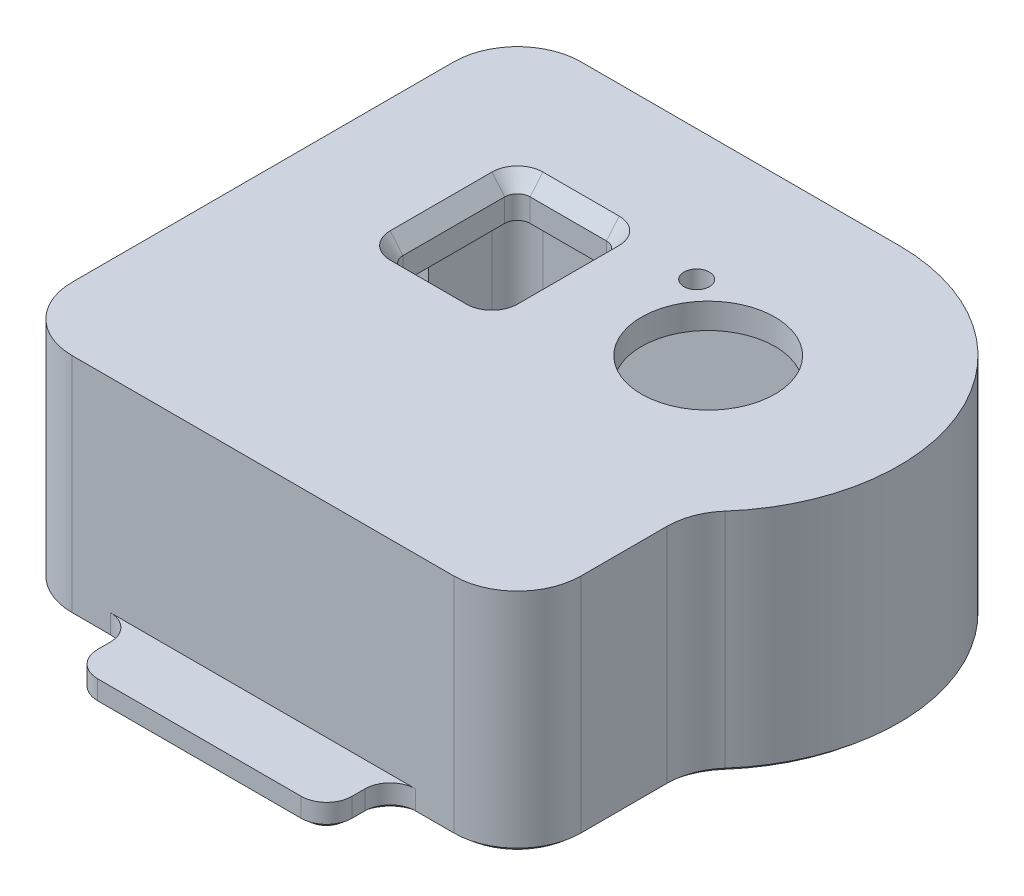
from build123d import *
from OCP.BRepFilletAPI import BRepFilletAPI_MakeChamfer

# Parameters (mm, degrees)
BOSS_EXTRUDE1_DEPTH = 18
FILLET1_R           = 5
SHELL1_T            = -3
SKETCH3_R           = 5.25
CUT_EXTRUDE1_DEPTH  = 44
SKETCH4_R           = 11.5
CUT_EXTRUDE2_DEPTH  = 1
SKETCH5_R           = 1
CUT_EXTRUDE3_DEPTH  = 44
CUT_EXTRUDE4_REACH  = 56.534
SKETCH6_W           = 10
SKETCH6_H           = 10
FILLET2_R           = 1
CUT_EXTRUDE7_REACH  = 45
SKETCH7_W           = 8
SKETCH7_H           = 10
FILLET3_R           = 1
SKETCH8_W           = 20
SKETCH8_H           = 5
SKETCH8_W_2         = 15
BOSS_EXTRUDE2_DEPTH = 2
FILLET4_R           = 2
FILLET5_R           = 5
FILLET6_R           = 5
CHAMFER2_SIZE       = 1
CHAMFER2_SIZE2      = 1.191753593
CHAMFER3_SIZE       = 0.5
CHAMFER3_SIZE2      = 0.595876796


with BuildPart() as part:
    # Sketch1 → Boss-Extrude1 (new body)
    with BuildSketch(Plane(origin=(0, 0, 0), x_dir=(1, 0, 0), z_dir=(0, 1, 0))):
        with BuildLine():
            Line((0, 15), (-30, 15))
            Line((-30, 15), (-30, -25))
            Line((-30, -25), (10, -25))
            Line((10, -25), (10, -11.180339887))
            ThreePointArc((10, -11.180339887), (14.012585384, 5.352331347), (0, 15))
        make_face()
    extrude(amount=BOSS_EXTRUDE1_DEPTH)

    # Fillet1
    fillet1_edges = [part.edges().sort_by_distance(p)[0] for p in [
        (10, 9, 25),
        (-30, 9, 25),
        (-30, 9, -15),
    ]]
    fillet(fillet1_edges, radius=FILLET1_R)

    # Shell1
    shell1_openings = [part.faces().sort_by_distance(p)[0] for p in [
        (-9.03204336, 0, 4.841264845),
    ]]
    offset(amount=SHELL1_T, openings=shell1_openings, kind=Kind.INTERSECTION)

    # Sketch3 → Cut-Extrude1 (cut, through all)
    with BuildSketch(Plane(origin=(0, 18, 0), x_dir=(1, 0, 0), z_dir=(0, 1, 0))):
        with Locations(Location((0, 0, 0), (0, 0, 270))):
            Circle(SKETCH3_R)
    extrude(amount=-CUT_EXTRUDE1_DEPTH, mode=Mode.SUBTRACT)

    # Sketch4 → Cut-Extrude2 (cut)
    with BuildSketch(Plane.XZ.offset(-15)):
        with Locations(Location((0, 0, 0), (0, 0, 270))):
            Circle(SKETCH4_R)
    extrude(amount=-CUT_EXTRUDE2_DEPTH, mode=Mode.SUBTRACT)

    # Sketch5 → Cut-Extrude3 (cut, through all)
    with BuildSketch(Plane(origin=(0, 18, 0), x_dir=(1, 0, 0), z_dir=(0, 1, 0))):
        with Locations(Location((-5.645747546, 4.737344683, 0), (0, 0, 270))):
            Circle(SKETCH5_R)
    extrude(amount=-CUT_EXTRUDE3_DEPTH, mode=Mode.SUBTRACT)

    # Sketch6 → Cut-Extrude4 (cut, up to next)
    with BuildSketch(Plane.ZY.offset(30), mode=Mode.PRIVATE) as cut_extrude4_sk1:
        with Locations((0, 5)):
            Rectangle(SKETCH6_W, SKETCH6_H)
    cut_extrude4_tool1 = extrude(cut_extrude4_sk1.sketch, amount=-CUT_EXTRUDE4_REACH, mode=Mode.PRIVATE) & part.part
    add(cut_extrude4_tool1.solids().sort_by_distance((-30, 5, 0))[0], mode=Mode.SUBTRACT)

    # Fillet2
    fillet2_edges = [part.edges().sort_by_distance(p)[0] for p in [
        (-28.5, 10, 5),
        (-28.5, 10, -5),
    ]]
    fillet(fillet2_edges, radius=FILLET2_R)

    # Sketch7 → Cut-Extrude7 (cut, up to next)
    with BuildSketch(Plane(origin=(0, 18, 0), x_dir=(1, 0, 0), z_dir=(0, 1, 0)), mode=Mode.PRIVATE) as cut_extrude7_sk1:
        with Locations((-16, 0)):
            Rectangle(SKETCH7_W, SKETCH7_H)
    cut_extrude7_tool1 = extrude(cut_extrude7_sk1.sketch, amount=-CUT_EXTRUDE7_REACH, mode=Mode.PRIVATE) & part.part
    add(cut_extrude7_tool1.solids().sort_by_distance((-16, 18, 0))[0], mode=Mode.SUBTRACT)

    # Fillet3
    fillet3_edges = [part.edges().sort_by_distance(p)[0] for p in [
        (-20, 16.5, 5),
        (-20, 16.5, -5),
        (-12, 16.5, -5),
        (-12, 16.5, 5),
    ]]
    fillet(fillet3_edges, radius=FILLET3_R)

    # Sketch8 → Boss-Extrude2 (add)
    with BuildSketch(Plane.XZ):
        with Locations((-10, 27.5)):
            Rectangle(SKETCH8_W, SKETCH8_H)
        with Locations((-15, -17.5)):
            Rectangle(SKETCH8_W_2, SKETCH8_H)
    extrude(amount=-BOSS_EXTRUDE2_DEPTH)

    # Fillet4
    fillet4_edges = [part.edges().sort_by_distance(p)[0] for p in [
        (-20, 1, 25),
        (-20, 1, 30),
        (0, 1, 30),
        (0, 1, 25),
        (-22.5, 1, -20),
        (-22.5, 1, -15),
        (-7.5, 1, -15),
        (-7.5, 1, -20),
    ]]
    fillet(fillet4_edges, radius=FILLET4_R)

    # Fillet5
    fillet5_edges = [part.edges().sort_by_distance(p)[0] for p in [
        (10, 9, 11.180339887),
    ]]
    fillet(fillet5_edges, radius=FILLET5_R)

    # Fillet6
    fillet6_edges = [part.edges().sort_by_distance(p)[0] for p in [
        (7, 7.5, 9.746794345),
    ]]
    fillet(fillet6_edges, radius=FILLET6_R)

    # Chamfer2
    chamfer2_edges = [part.edges().sort_by_distance(p)[0] for p in [
        (-16, 18, -5),
        (-12, 18, 0),
        (-16, 18, 5),
        (-20, 18, 0),
        (-12.292893219, 18, -4.707106781),
        (-12.292893219, 18, 4.707106781),
        (-19.707106781, 18, 4.707106781),
        (-19.707106781, 18, -4.707106781),
    ]]
    chamfer2_side = [part.faces().sort_by_distance(p)[0] for p in [
        (-9.188665207, 18, 5.405494126),
    ]]
    chamfer(chamfer2_edges, length=CHAMFER2_SIZE, length2=CHAMFER2_SIZE2, reference=chamfer2_side[0])

    # Chamfer3: one chamfer whose edges measure the first distance from different faces: ONE call of the kernel's chamfer builder (chamfer() names one face for all edges)
    chamfer3_edges_1 = [part.edges().sort_by_distance(p)[0] for p in [
        (10, 0, 16.614378278),
    ]]
    chamfer3_side_1 = [part.faces().sort_by_distance(p)[0] for p in [
        (10, 9, 16.614378278),
    ]]
    chamfer3_edges_2 = [part.edges().sort_by_distance(p)[0] for p in [
        (-22.5, 0, -17.5),
    ]]
    chamfer3_side_2 = [part.faces().sort_by_distance(p)[0] for p in [
        (-22.5, 1, -17.5),
    ]]
    chamfer3_edges_3 = [part.edges().sort_by_distance(p)[0] for p in [
        (-24.75, 0, -15),
        (-2.75, 0, -15),
    ]]
    chamfer3_side_3 = [part.faces().sort_by_distance(p)[0] for p in [
        (-12.269417476, 9.737864078, -15),
    ]]
    chamfer3_edges_4 = [part.edges().sort_by_distance(p)[0] for p in [
        (-15, 0, -20),
    ]]
    chamfer3_side_4 = [part.faces().sort_by_distance(p)[0] for p in [
        (-15, 1, -20),
    ]]
    chamfer3_edges_5 = [part.edges().sort_by_distance(p)[0] for p in [
        (-7.5, 0, -17.5),
    ]]
    chamfer3_side_5 = [part.faces().sort_by_distance(p)[0] for p in [
        (-7.5, 1, -17.5),
    ]]
    chamfer3_edges_6 = [part.edges().sort_by_distance(p)[0] for p in [
        (3.5, 0, 25),
        (-23.5, 0, 25),
    ]]
    chamfer3_side_6 = [part.faces().sort_by_distance(p)[0] for p in [
        (-10, 9.780487805, 25),
    ]]
    chamfer3_edges_7 = [part.edges().sort_by_distance(p)[0] for p in [
        (0, 0, 27.5),
    ]]
    chamfer3_side_7 = [part.faces().sort_by_distance(p)[0] for p in [
        (0, 1, 27.5),
    ]]
    chamfer3_edges_8 = [part.edges().sort_by_distance(p)[0] for p in [
        (-10, 0, 30),
    ]]
    chamfer3_side_8 = [part.faces().sort_by_distance(p)[0] for p in [
        (-10, 1, 30),
    ]]
    chamfer3_edges_9 = [part.edges().sort_by_distance(p)[0] for p in [
        (-20, 0, 27.5),
    ]]
    chamfer3_side_9 = [part.faces().sort_by_distance(p)[0] for p in [
        (-20, 1, 27.5),
    ]]
    chamfer3_edges_10 = [part.edges().sort_by_distance(p)[0] for p in [
        (-19.414213562, 0, 29.414213562),
    ]]
    chamfer3_side_10 = [part.faces().sort_by_distance(p)[0] for p in [
        (-19.414213562, 1, 29.414213562),
    ]]
    chamfer3_edges_11 = [part.edges().sort_by_distance(p)[0] for p in [
        (-0.585786438, 0, 29.414213562),
    ]]
    chamfer3_side_11 = [part.faces().sort_by_distance(p)[0] for p in [
        (-0.585786438, 1, 29.414213562),
    ]]
    chamfer3_edges_12 = [part.edges().sort_by_distance(p)[0] for p in [
        (-8.085786438, 0, -19.414213562),
    ]]
    chamfer3_side_12 = [part.faces().sort_by_distance(p)[0] for p in [
        (-8.085786438, 1, -19.414213562),
    ]]
    chamfer3_edges_13 = [part.edges().sort_by_distance(p)[0] for p in [
        (-21.914213562, 0, -19.414213562),
    ]]
    chamfer3_side_13 = [part.faces().sort_by_distance(p)[0] for p in [
        (-21.914213562, 1, -19.414213562),
    ]]
    chamfer3_edges_14 = [part.edges().sort_by_distance(p)[0] for p in [
        (-30, 0, -7.5),
        (-30, 0, 12.5),
    ]]
    chamfer3_side_14 = [part.faces().sort_by_distance(p)[0] for p in [
        (-30, 9.908961826, 6.130383675),
    ]]
    chamfer3_edges_15 = [part.edges().sort_by_distance(p)[0] for p in [
        (-28.535533906, 0, -13.535533906),
    ]]
    chamfer3_side_15 = [part.faces().sort_by_distance(p)[0] for p in [
        (-28.535533906, 9, -13.535533906),
    ]]
    chamfer3_edges_16 = [part.edges().sort_by_distance(p)[0] for p in [
        (-23.085786438, 0, -15.585786438),
    ]]
    chamfer3_side_16 = [part.faces().sort_by_distance(p)[0] for p in [
        (-23.085786438, 1, -15.585786438),
    ]]
    chamfer3_edges_17 = [part.edges().sort_by_distance(p)[0] for p in [
        (-28.535533906, 0, 23.535533906),
    ]]
    chamfer3_side_17 = [part.faces().sort_by_distance(p)[0] for p in [
        (-28.535533906, 9, 23.535533906),
    ]]
    chamfer3_edges_18 = [part.edges().sort_by_distance(p)[0] for p in [
        (-6.914213562, 0, -15.585786438),
    ]]
    chamfer3_side_18 = [part.faces().sort_by_distance(p)[0] for p in [
        (-6.914213562, 1, -15.585786438),
    ]]
    chamfer3_edges_19 = [part.edges().sort_by_distance(p)[0] for p in [
        (0.585786438, 0, 25.585786438),
    ]]
    chamfer3_side_19 = [part.faces().sort_by_distance(p)[0] for p in [
        (0.585786438, 1, 25.585786438),
    ]]
    chamfer3_edges_20 = [part.edges().sort_by_distance(p)[0] for p in [
        (-20.585786438, 0, 25.585786438),
    ]]
    chamfer3_side_20 = [part.faces().sort_by_distance(p)[0] for p in [
        (-20.585786438, 1, 25.585786438),
    ]]
    chamfer3_edges_21 = [part.edges().sort_by_distance(p)[0] for p in [
        (8.535533906, 0, 23.535533906),
    ]]
    chamfer3_side_21 = [part.faces().sort_by_distance(p)[0] for p in [
        (8.535533906, 9, 23.535533906),
    ]]
    chamfer3_edges_22 = [part.edges().sort_by_distance(p)[0] for p in [
        (13.671567416, 0, -6.171567416),
    ]]
    chamfer3_side_22 = [part.faces().sort_by_distance(p)[0] for p in [
        (13.671567416, 9, -6.171567416),
    ]]
    chamfer3_edges_23 = [part.edges().sort_by_distance(p)[0] for p in [
        (10.322928267, 0, 11.460989602),
    ]]
    chamfer3_side_23 = [part.faces().sort_by_distance(p)[0] for p in [
        (10.322928267, 9, 11.460989602),
    ]]
    chamfer3_edges_24 = [part.edges().sort_by_distance(p)[0] for p in [
        (11.090522742, 0, -4.582609007),
    ]]
    chamfer3_side_24 = [part.faces().sort_by_distance(p)[0] for p in [
        (11.090522742, 7.5, -4.582609007),
    ]]
    chamfer3_edges_25 = [part.edges().sort_by_distance(p)[0] for p in [
        (7.382259274, 0, 10.124182107),
    ]]
    chamfer3_side_25 = [part.faces().sort_by_distance(p)[0] for p in [
        (7.382259274, 7.5, 10.124182107),
    ]]
    chamfer3_edges_26 = [part.edges().sort_by_distance(p)[0] for p in [
        (-12.5, 0, -12),
    ]]
    chamfer3_side_26 = [part.faces().sort_by_distance(p)[0] for p in [
        (-12.5, 7.5, -12),
    ]]
    chamfer3_edges_27 = [part.edges().sort_by_distance(p)[0] for p in [
        (-27, 0, -7.5),
        (-27, 0, 12.5),
    ]]
    chamfer3_side_27 = [part.faces().sort_by_distance(p)[0] for p in [
        (-27, 8.216199267, 6.420697751),
    ]]
    chamfer3_edges_28 = [part.edges().sort_by_distance(p)[0] for p in [
        (-10, 0, 22),
    ]]
    chamfer3_side_28 = [part.faces().sort_by_distance(p)[0] for p in [
        (-10, 7.5, 22),
    ]]
    chamfer3_edges_29 = [part.edges().sort_by_distance(p)[0] for p in [
        (7, 0, 16.020797289),
    ]]
    chamfer3_side_29 = [part.faces().sort_by_distance(p)[0] for p in [
        (7, 7.5, 16.020797289),
    ]]
    chamfer3_edges_30 = [part.edges().sort_by_distance(p)[0] for p in [
        (6.414213562, 0, 21.414213562),
    ]]
    chamfer3_side_30 = [part.faces().sort_by_distance(p)[0] for p in [
        (6.414213562, 7.5, 21.414213562),
    ]]
    chamfer3_edges_31 = [part.edges().sort_by_distance(p)[0] for p in [
        (-26.414213562, 0, 21.414213562),
    ]]
    chamfer3_side_31 = [part.faces().sort_by_distance(p)[0] for p in [
        (-26.414213562, 7.5, 21.414213562),
    ]]
    chamfer3_edges_32 = [part.edges().sort_by_distance(p)[0] for p in [
        (-26.414213562, 0, -11.414213562),
    ]]
    chamfer3_side_32 = [part.faces().sort_by_distance(p)[0] for p in [
        (-26.414213562, 7.5, -11.414213562),
    ]]
    chamfer3 = BRepFilletAPI_MakeChamfer(part.part.solid().wrapped)
    for e in chamfer3_edges_1:
        chamfer3.Add(CHAMFER3_SIZE, CHAMFER3_SIZE2, e.wrapped, chamfer3_side_1[0].wrapped)  # the first distance lies on this face
    for e in chamfer3_edges_2:
        chamfer3.Add(CHAMFER3_SIZE, CHAMFER3_SIZE2, e.wrapped, chamfer3_side_2[0].wrapped)  # the first distance lies on this face
    for e in chamfer3_edges_3:
        chamfer3.Add(CHAMFER3_SIZE, CHAMFER3_SIZE2, e.wrapped, chamfer3_side_3[0].wrapped)  # the first distance lies on this face
    for e in chamfer3_edges_4:
        chamfer3.Add(CHAMFER3_SIZE, CHAMFER3_SIZE2, e.wrapped, chamfer3_side_4[0].wrapped)  # the first distance lies on this face
    for e in chamfer3_edges_5:
        chamfer3.Add(CHAMFER3_SIZE, CHAMFER3_SIZE2, e.wrapped, chamfer3_side_5[0].wrapped)  # the first distance lies on this face
    for e in chamfer3_edges_6:
        chamfer3.Add(CHAMFER3_SIZE, CHAMFER3_SIZE2, e.wrapped, chamfer3_side_6[0].wrapped)  # the first distance lies on this face
    for e in chamfer3_edges_7:
        chamfer3.Add(CHAMFER3_SIZE, CHAMFER3_SIZE2, e.wrapped, chamfer3_side_7[0].wrapped)  # the first distance lies on this face
    for e in chamfer3_edges_8:
        chamfer3.Add(CHAMFER3_SIZE, CHAMFER3_SIZE2, e.wrapped, chamfer3_side_8[0].wrapped)  # the first distance lies on this face
    for e in chamfer3_edges_9:
        chamfer3.Add(CHAMFER3_SIZE, CHAMFER3_SIZE2, e.wrapped, chamfer3_side_9[0].wrapped)  # the first distance lies on this face
    for e in chamfer3_edges_10:
        chamfer3.Add(CHAMFER3_SIZE, CHAMFER3_SIZE2, e.wrapped, chamfer3_side_10[0].wrapped)  # the first distance lies on this face
    for e in chamfer3_edges_11:
        chamfer3.Add(CHAMFER3_SIZE, CHAMFER3_SIZE2, e.wrapped, chamfer3_side_11[0].wrapped)  # the first distance lies on this face
    for e in chamfer3_edges_12:
        chamfer3.Add(CHAMFER3_SIZE, CHAMFER3_SIZE2, e.wrapped, chamfer3_side_12[0].wrapped)  # the first distance lies on this face
    for e in chamfer3_edges_13:
        chamfer3.Add(CHAMFER3_SIZE, CHAMFER3_SIZE2, e.wrapped, chamfer3_side_13[0].wrapped)  # the first distance lies on this face
    for e in chamfer3_edges_14:
        chamfer3.Add(CHAMFER3_SIZE, CHAMFER3_SIZE2, e.wrapped, chamfer3_side_14[0].wrapped)  # the first distance lies on this face
    for e in chamfer3_edges_15:
        chamfer3.Add(CHAMFER3_SIZE, CHAMFER3_SIZE2, e.wrapped, chamfer3_side_15[0].wrapped)  # the first distance lies on this face
    for e in chamfer3_edges_16:
        chamfer3.Add(CHAMFER3_SIZE, CHAMFER3_SIZE2, e.wrapped, chamfer3_side_16[0].wrapped)  # the first distance lies on this face
    for e in chamfer3_edges_17:
        chamfer3.Add(CHAMFER3_SIZE, CHAMFER3_SIZE2, e.wrapped, chamfer3_side_17[0].wrapped)  # the first distance lies on this face
    for e in chamfer3_edges_18:
        chamfer3.Add(CHAMFER3_SIZE, CHAMFER3_SIZE2, e.wrapped, chamfer3_side_18[0].wrapped)  # the first distance lies on this face
    for e in chamfer3_edges_19:
        chamfer3.Add(CHAMFER3_SIZE, CHAMFER3_SIZE2, e.wrapped, chamfer3_side_19[0].wrapped)  # the first distance lies on this face
    for e in chamfer3_edges_20:
        chamfer3.Add(CHAMFER3_SIZE, CHAMFER3_SIZE2, e.wrapped, chamfer3_side_20[0].wrapped)  # the first distance lies on this face
    for e in chamfer3_edges_21:
        chamfer3.Add(CHAMFER3_SIZE, CHAMFER3_SIZE2, e.wrapped, chamfer3_side_21[0].wrapped)  # the first distance lies on this face
    for e in chamfer3_edges_22:
        chamfer3.Add(CHAMFER3_SIZE, CHAMFER3_SIZE2, e.wrapped, chamfer3_side_22[0].wrapped)  # the first distance lies on this face
    for e in chamfer3_edges_23:
        chamfer3.Add(CHAMFER3_SIZE, CHAMFER3_SIZE2, e.wrapped, chamfer3_side_23[0].wrapped)  # the first distance lies on this face
    for e in chamfer3_edges_24:
        chamfer3.Add(CHAMFER3_SIZE, CHAMFER3_SIZE2, e.wrapped, chamfer3_side_24[0].wrapped)  # the first distance lies on this face
    for e in chamfer3_edges_25:
        chamfer3.Add(CHAMFER3_SIZE, CHAMFER3_SIZE2, e.wrapped, chamfer3_side_25[0].wrapped)  # the first distance lies on this face
    for e in chamfer3_edges_26:
        chamfer3.Add(CHAMFER3_SIZE, CHAMFER3_SIZE2, e.wrapped, chamfer3_side_26[0].wrapped)  # the first distance lies on this face
    for e in chamfer3_edges_27:
        chamfer3.Add(CHAMFER3_SIZE, CHAMFER3_SIZE2, e.wrapped, chamfer3_side_27[0].wrapped)  # the first distance lies on this face
    for e in chamfer3_edges_28:
        chamfer3.Add(CHAMFER3_SIZE, CHAMFER3_SIZE2, e.wrapped, chamfer3_side_28[0].wrapped)  # the first distance lies on this face
    for e in chamfer3_edges_29:
        chamfer3.Add(CHAMFER3_SIZE, CHAMFER3_SIZE2, e.wrapped, chamfer3_side_29[0].wrapped)  # the first distance lies on this face
    for e in chamfer3_edges_30:
        chamfer3.Add(CHAMFER3_SIZE, CHAMFER3_SIZE2, e.wrapped, chamfer3_side_30[0].wrapped)  # the first distance lies on this face
    for e in chamfer3_edges_31:
        chamfer3.Add(CHAMFER3_SIZE, CHAMFER3_SIZE2, e.wrapped, chamfer3_side_31[0].wrapped)  # the first distance lies on this face
    for e in chamfer3_edges_32:
        chamfer3.Add(CHAMFER3_SIZE, CHAMFER3_SIZE2, e.wrapped, chamfer3_side_32[0].wrapped)  # the first distance lies on this face
    add(Compound.cast(chamfer3.Shape()), mode=Mode.REPLACE)


solid = part.part
